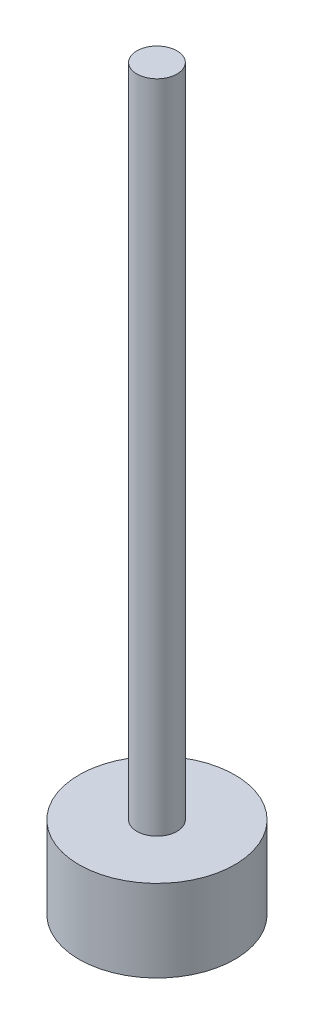
from build123d import *

# Parameters (mm, degrees)
SKETCH1_R           = 12.065
BOSS_EXTRUDE1_DEPTH = 12.7
SKETCH2_R           = 3.1115
BOSS_EXTRUDE2_DEPTH = 101.6


with BuildPart() as part:
    # Sketch1 → Boss-Extrude1 (new body)
    with BuildSketch(Plane(origin=(0, 0, 0), x_dir=(1, 0, 0), z_dir=(0, 1, 0))):
        with Locations(Location((0, 0, 0), (0, 0, 270))):
            Circle(SKETCH1_R)
    extrude(amount=BOSS_EXTRUDE1_DEPTH)

    # Sketch2 → Boss-Extrude2 (add)
    with BuildSketch(Plane(origin=(0, 12.7, 0), x_dir=(1, 0, 0), z_dir=(0, 1, 0))):
        with Locations(Location((0, 0, 0), (0, 0, 270))):
            Circle(SKETCH2_R)
    extrude(amount=BOSS_EXTRUDE2_DEPTH)


solid = part.part
